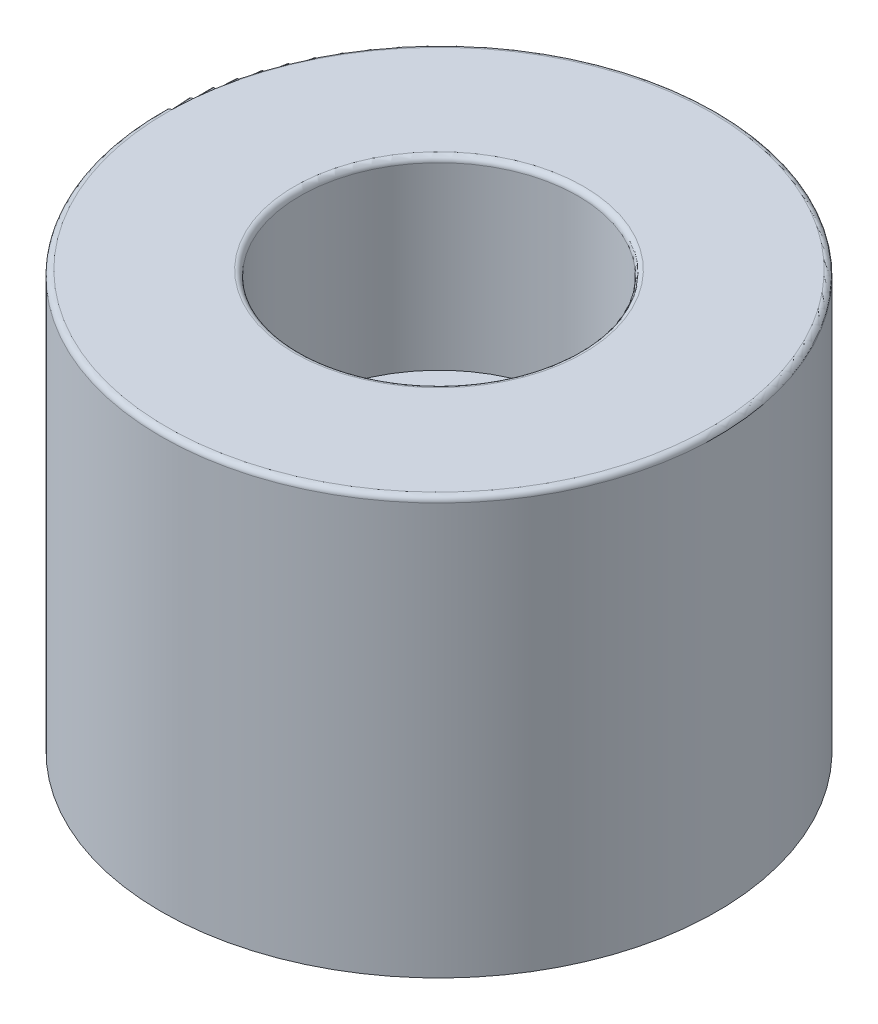
from build123d import *

# Parameters (mm, degrees)
FILLET1_R = 0.1905
FILLET2_R = 0.1905


with BuildPart() as part:
    # Sketch2 → Revolve1 (revolve)
    with BuildSketch(Plane.XY, mode=Mode.PRIVATE) as revolve1_sk:
        Polygon((-9.525, -7.14375), (-9.525, 7.14375), (-4.7625, 7.14375), (-4.7625, 0.79375), (-2.38125, 0.79375), (-2.38125, -7.14375), align=None)
    revolve(revolve1_sk.sketch.rotate(Axis((0, -7.14375, 0), (0, 1, 0)), 270), axis=Axis((0, -7.14375, 0), (0, 1, 0)))

    # Fillet1
    fillet1_edges = [part.edges().sort_by_distance(p)[0] for p in [
        (0, 7.14375, 4.7625),
    ]]
    fillet(fillet1_edges, radius=FILLET1_R)

    # Fillet2
    fillet2_edges = [part.edges().sort_by_distance(p)[0] for p in [
        (0, 7.14375, 9.525),
    ]]
    fillet(fillet2_edges, radius=FILLET2_R)


solid = part.part
